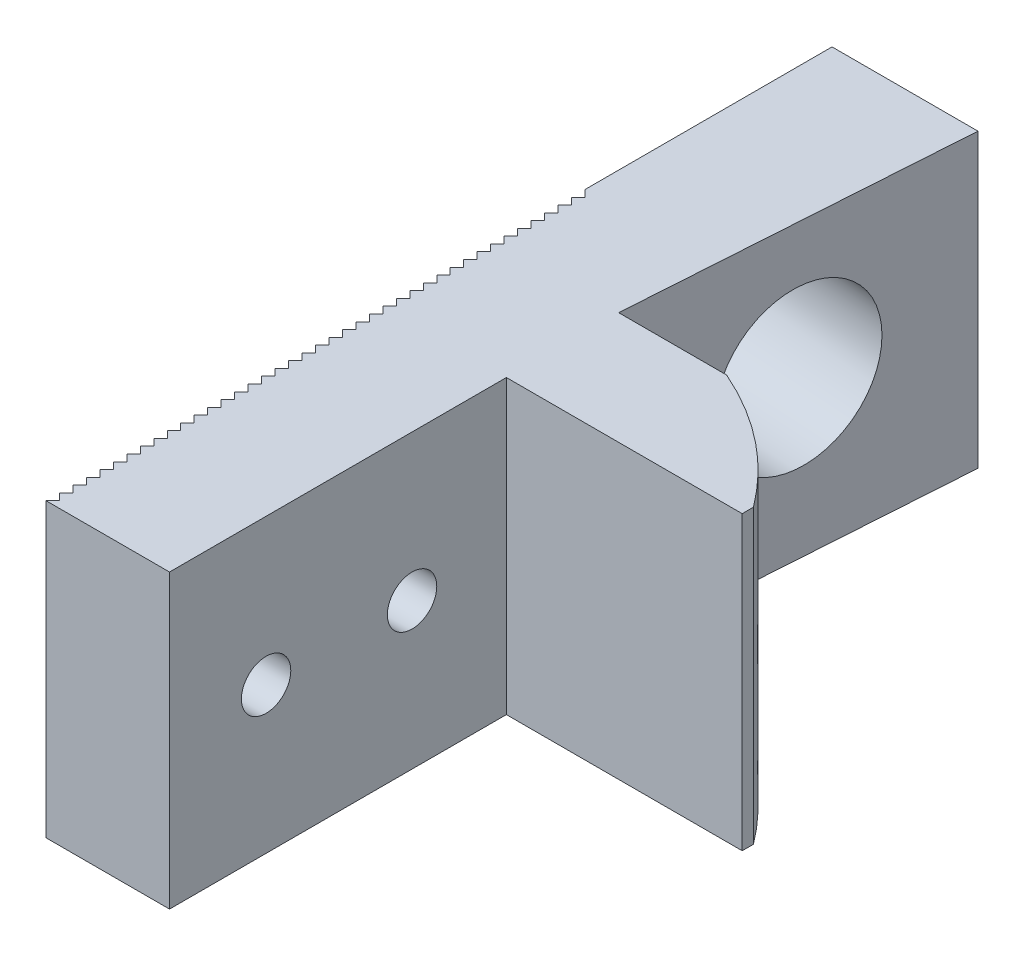
from build123d import *

# Parameters (mm, degrees)
EXTRUDE_1_DEPTH     = 13
SKETCH_4_R          = 3.5
CUT_EXTRUDE_3_DEPTH = 40.419530037
SKETCH_5_R          = 1.1
CUT_EXTRUDE_4_DEPTH = 10


with BuildPart() as part:
    # 草图1 → 凸台-拉伸1 (new body)
    with BuildSketch(Plane(origin=(0, 0, 0), x_dir=(1, 0, 0), z_dir=(0, 1, 0))):
        with BuildLine():
            Line((0, 35), (6.5, 35))
            Line((6.5, 35), (5.5, 20))
            Line((5.5, 20), (10.30634728, 20))
            add(Edge.make_bspline(
                [(10.30634728, 20), (13.762117506, 18.48353704), (16, 15.5)],
                knots=[0, 0, 0, 1, 1, 1], degree=2))
            Line((16, 15.5), (16, 15))
            Line((16, 15), (5.5, 15))
            Line((5.5, 15), (5.5, 0))
            Line((5.5, 0), (0, 0))
            Line((0, 0), (0.3, 0.3))
            Line((0.3, 0.3), (0, 0.6))
            Line((0, 0.6), (0.3, 0.9))
            Line((0.3, 0.9), (0, 1.2))
            Line((0, 1.2), (0.3, 1.5))
            Line((0.3, 1.5), (0, 1.8))
            Line((0, 1.8), (0.3, 2.1))
            Line((0.3, 2.1), (0, 2.4))
            Line((0, 2.4), (0.3, 2.7))
            Line((0.3, 2.7), (0, 3))
            Line((0, 3), (0.3, 3.3))
            Line((0.3, 3.3), (0, 3.6))
            Line((0, 3.6), (0.3, 3.9))
            Line((0.3, 3.9), (0, 4.2))
            Line((0, 4.2), (0.3, 4.5))
            Line((0.3, 4.5), (0, 4.8))
            Line((0, 4.8), (0.3, 5.1))
            Line((0.3, 5.1), (0, 5.4))
            Line((0, 5.4), (0.3, 5.7))
            Line((0.3, 5.7), (0, 6))
            Line((0, 6), (0.3, 6.3))
            Line((0.3, 6.3), (0, 6.6))
            Line((0, 6.6), (0.3, 6.9))
            Line((0.3, 6.9), (0, 7.2))
            Line((0, 7.2), (0.3, 7.5))
            Line((0.3, 7.5), (0, 7.8))
            Line((0, 7.8), (0.3, 8.1))
            Line((0.3, 8.1), (0, 8.4))
            Line((0, 8.4), (0.3, 8.7))
            Line((0.3, 8.7), (0, 9))
            Line((0, 9), (0.3, 9.3))
            Line((0.3, 9.3), (0, 9.6))
            Line((0, 9.6), (0.3, 9.9))
            Line((0.3, 9.9), (0, 10.2))
            Line((0, 10.2), (0.3, 10.5))
            Line((0.3, 10.5), (0, 10.8))
            Line((0, 10.8), (0.3, 11.1))
            Line((0.3, 11.1), (0, 11.4))
            Line((0, 11.4), (0.3, 11.7))
            Line((0.3, 11.7), (0, 12))
            Line((0, 12), (0.3, 12.3))
            Line((0.3, 12.3), (0, 12.6))
            Line((0, 12.6), (0.3, 12.9))
            Line((0.3, 12.9), (0, 13.2))
            Line((0, 13.2), (0.3, 13.5))
            Line((0.3, 13.5), (0, 13.8))
            Line((0, 13.8), (0.3, 14.1))
            Line((0.3, 14.1), (0, 14.4))
            Line((0, 14.4), (0.3, 14.7))
            Line((0.3, 14.7), (0, 15))
            Line((0, 15), (0.3, 15.3))
            Line((0.3, 15.3), (0, 15.6))
            Line((0, 15.6), (0.3, 15.9))
            Line((0.3, 15.9), (0, 16.2))
            Line((0, 16.2), (0.3, 16.5))
            Line((0.3, 16.5), (0, 16.8))
            Line((0, 16.8), (0.3, 17.1))
            Line((0.3, 17.1), (0, 17.4))
            Line((0, 17.4), (0.3, 17.7))
            Line((0.3, 17.7), (0, 18))
            Line((0, 18), (0.3, 18.3))
            Line((0.3, 18.3), (0, 18.6))
            Line((0, 18.6), (0.3, 18.9))
            Line((0.3, 18.9), (0, 19.2))
            Line((0, 19.2), (0.3, 19.5))
            Line((0.3, 19.5), (0, 19.8))
            Line((0, 19.8), (0.3, 20.1))
            Line((0.3, 20.1), (0, 20.4))
            Line((0, 20.4), (0.3, 20.7))
            Line((0.3, 20.7), (0, 21))
            Line((0, 21), (0.3, 21.3))
            Line((0.3, 21.3), (0, 21.6))
            Line((0, 21.6), (0.3, 21.9))
            Line((0.3, 21.9), (0, 22.2))
            Line((0, 22.2), (0.3, 22.5))
            Line((0.3, 22.5), (0, 22.8))
            Line((0, 22.8), (0.3, 23.1))
            Line((0.3, 23.1), (0, 23.4))
            Line((0, 23.4), (0.3, 23.7))
            Line((0.3, 23.7), (0, 24))
            Line((0, 24), (0, 35))
        make_face()
    extrude(amount=EXTRUDE_1_DEPTH)

    # 草图4 → 切除-拉伸3 (cut, through all)
    with BuildSketch(Plane(origin=(4.148230088, 0, 0.276548673), x_dir=(0.06651901052377392, 0, -0.9977851578566089), z_dir=(0.9977851578566089, 0, 0.06651901052377392))):
        with Locations((27.838205904, 7)):
            Circle(SKETCH_4_R)
    extrude(amount=-CUT_EXTRUDE_3_DEPTH, mode=Mode.SUBTRACT)

    # 草图5 → 切除-拉伸4 (cut)
    with BuildSketch(Plane(origin=(5.5, 0, 0), x_dir=(0, 0, -1), z_dir=(1, 0, 0))):
        with Locations((10.8, 6.5)):
            Circle(SKETCH_5_R)
        with Locations((4.3, 6.5)):
            Circle(SKETCH_5_R)
    extrude(amount=-CUT_EXTRUDE_4_DEPTH, mode=Mode.SUBTRACT)


solid = part.part
